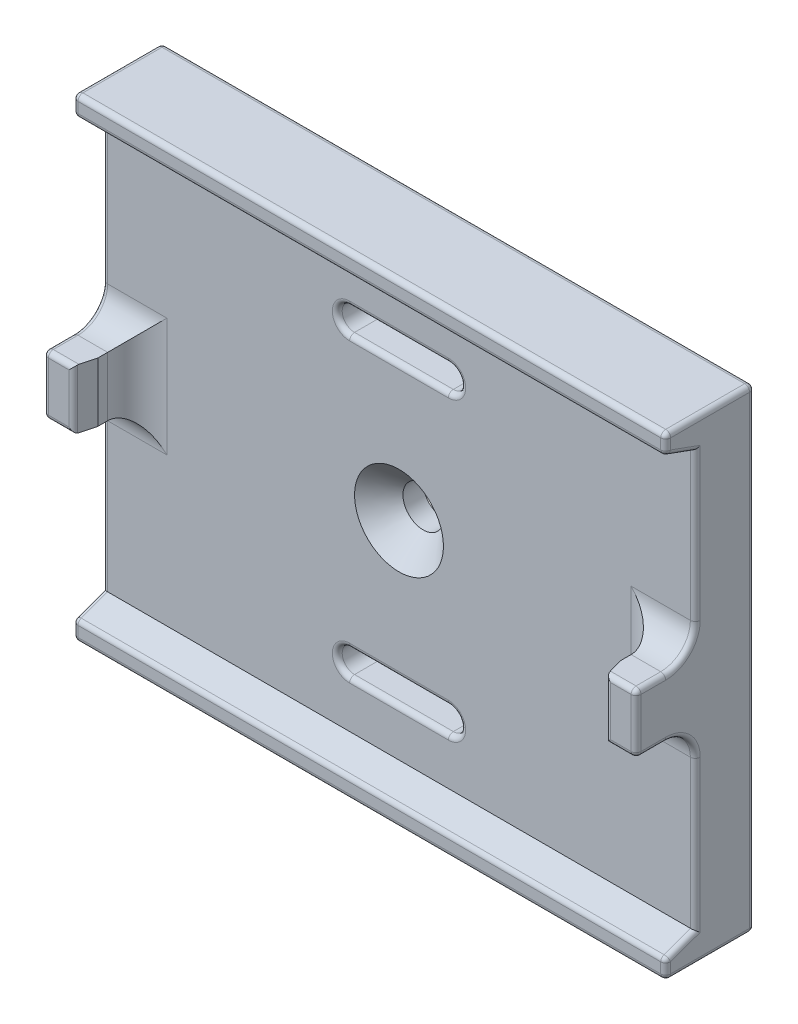
from build123d import *
from OCP.BRepFilletAPI import BRepFilletAPI_MakeChamfer

# Parameters (mm, degrees)
AUFSATZ_LINEAR_AUSTRAGEN1_DEPTH       = 60
AUFSATZ_LINEAR_AUSTRAGEN1_DEPTH_BACK  = 60
FORMSENKUNG_F_R_M8_SFHCS1_D           = 8.2
FORMSENKUNG_F_R_M8_SFHCS1_CSINK_D     = 18
FORMSENKUNG_F_R_M8_SFHCS1_CSINK_ANGLE = 90
SCHNITT_LINEAR_AUSTRAGEN1_DEPTH       = 3
SKIZZE5_W                             = 7
SKIZZE5_H                             = 12
AUFSATZ_LINEAR_AUSTRAGEN2_DEPTH       = 12
FASE1_SIZE                            = 4
FASE1_SIZE2                           = 1.07179677
VERRUNDUNG1_R                         = 6
SCHNITT_LINEAR_AUSTRAGEN2_DEPTH       = 12
VERRUNDUNG2_R                         = 1


with BuildPart() as part:
    # Skizze1 → Aufsatz-Linear austragen1 (new, two sides: drawn at the far end of the back side and taken through both)
    with BuildSketch(Plane(origin=(0, 0, 0), x_dir=(0, 0, -1), z_dir=(1, 0, 0)).offset(-AUFSATZ_LINEAR_AUSTRAGEN1_DEPTH_BACK)):
        Polygon((0, 48), (0, -48), (-18, -48), (-18, -44.183821406), (-12, -42), (-12, 42), (-18, 44.183821406), (-18, 48), align=None)
    extrude(amount=AUFSATZ_LINEAR_AUSTRAGEN1_DEPTH + AUFSATZ_LINEAR_AUSTRAGEN1_DEPTH_BACK)

    # Formsenkung für M8 SFHCS1 (through all)
    with Locations(Plane.XY.offset(12)):
        with Locations((0, 0)):
            CounterSinkHole(FORMSENKUNG_F_R_M8_SFHCS1_D / 2, FORMSENKUNG_F_R_M8_SFHCS1_CSINK_D / 2, counter_sink_angle=FORMSENKUNG_F_R_M8_SFHCS1_CSINK_ANGLE)

    # Skizze4 → Schnitt-Linear austragen1 (cut)
    with BuildSketch(Plane(origin=(0, 0, 0), x_dir=(-1, 0, 0), z_dir=(0, 0, -1))):
        with BuildLine():
            Line((18.25, -20.25), (-18.25, -20.25))
            ThreePointArc((-18.25, -20.25), (-19.664213562, -19.664213562), (-20.25, -18.25))
            Line((-20.25, -18.25), (-20.25, 18.25))
            ThreePointArc((-20.25, 18.25), (-19.664213562, 19.664213562), (-18.25, 20.25))
            Line((-18.25, 20.25), (18.25, 20.25))
            ThreePointArc((18.25, 20.25), (19.664213562, 19.664213562), (20.25, 18.25))
            Line((20.25, 18.25), (20.25, -18.25))
            ThreePointArc((20.25, -18.25), (19.664213562, -19.664213562), (18.25, -20.25))
        make_face()
    extrude(amount=-SCHNITT_LINEAR_AUSTRAGEN1_DEPTH, mode=Mode.SUBTRACT)

    # Skizze5 → Aufsatz-Linear austragen2 (add)
    with BuildSketch(Plane.XY.offset(12)):
        with Locations((-56.5, 0)):
            Rectangle(SKIZZE5_W, SKIZZE5_H)
        with Locations((56.5, 0)):
            Rectangle(SKIZZE5_W, SKIZZE5_H)
    extrude(amount=AUFSATZ_LINEAR_AUSTRAGEN2_DEPTH)

    # Fase1: one chamfer whose edges measure the first distance from different faces: ONE call of the kernel's chamfer builder (chamfer() names one face for all edges)
    fase1_edges_1 = [part.edges().sort_by_distance(p)[0] for p in [
        (-53, 0, 24),
    ]]
    fase1_side_1 = [part.faces().sort_by_distance(p)[0] for p in [
        (-53, 0, 18),
    ]]
    fase1_edges_2 = [part.edges().sort_by_distance(p)[0] for p in [
        (53, 0, 24),
    ]]
    fase1_side_2 = [part.faces().sort_by_distance(p)[0] for p in [
        (53, 0, 18),
    ]]
    fase1 = BRepFilletAPI_MakeChamfer(part.part.solid().wrapped)
    for e in fase1_edges_1:
        fase1.Add(FASE1_SIZE, FASE1_SIZE2, e.wrapped, fase1_side_1[0].wrapped)  # the first distance lies on this face
    for e in fase1_edges_2:
        fase1.Add(FASE1_SIZE, FASE1_SIZE2, e.wrapped, fase1_side_2[0].wrapped)  # the first distance lies on this face
    add(Compound.cast(fase1.Shape()), mode=Mode.REPLACE)

    # Verrundung1
    verrundung1_edges = [part.edges().sort_by_distance(p)[0] for p in [
        (56.5, -6, 12),
        (56.5, 6, 12),
        (-56.5, 6, 12),
        (-56.5, -6, 12),
        (-53, 0, 12),
        (53, 0, 12),
    ]]
    fillet(verrundung1_edges, radius=VERRUNDUNG1_R)

    # Skizze6 → Schnitt-Linear austragen2 (cut)
    with BuildSketch(Plane.XY.offset(12)):
        with BuildLine():
            Line((-10, 32.5), (10, 32.5))
            ThreePointArc((10, 32.5), (12.5, 30), (10, 27.5))
            Line((10, 27.5), (-10, 27.5))
            ThreePointArc((-10, 27.5), (-12.5, 30), (-10, 32.5))
        make_face()
        with BuildLine():
            Line((-10, -32.5), (10, -32.5))
            ThreePointArc((10, -32.5), (12.5, -30), (10, -27.5))
            Line((10, -27.5), (-10, -27.5))
            ThreePointArc((-10, -27.5), (-12.5, -30), (-10, -32.5))
        make_face()
    extrude(amount=-SCHNITT_LINEAR_AUSTRAGEN2_DEPTH, mode=Mode.SUBTRACT)

    # Verrundung2
    verrundung2_edges = [part.edges().sort_by_distance(p)[0] for p in [
        (60, -27, 12),
        (60, -7.757359313, 13.757359313),
        (60, 27, 12),
        (60, 7.757359313, 13.757359313),
        (-60, 6, 21),
        (-60, 27, 12),
        (-60, -27, 12),
        (-60, -6, 21),
        (60, 0, 24),
        (57.035898385, -6, 24),
        (54.07179677, 0, 24),
        (57.035898385, 6, 24),
        (-60, 0, 24),
        (-57.035898385, 6, 24),
        (-54.07179677, 0, 24),
        (-57.035898385, -6, 24),
        (0, 48, 18),
        (-60, 46.091910703, 18),
        (0, 44.183821406, 18),
        (60, 46.091910703, 18),
        (60, -46.091910703, 18),
        (-60, -46.091910703, 18),
        (0, -44.183821406, 18),
        (0, -48, 18),
        (-60, -48, 9),
        (-60, 48, 9),
        (-60, 0, 0),
        (0, -48, 0),
        (60, -48, 9),
        (60, 48, 9),
        (60, 0, 0),
        (0, 48, 0),
        (60, -6, 21),
        (60, 6, 21),
        (-60, 7.757359313, 13.757359313),
        (-60, -7.757359313, 13.757359313),
        (12.5, 30, 0),
        (0, 27.5, 0),
        (-12.5, 30, 0),
        (12.5, -30, 0),
        (0, -32.5, 0),
        (-12.5, -30, 0),
        (-12.5, 30, 12),
        (0, 32.5, 12),
        (12.5, 30, 12),
        (12.5, -30, 12),
        (0, -32.5, 12),
        (-12.5, -30, 12),
        (0, 32.5, 0),
        (0, -27.5, 0),
        (0, 27.5, 12),
        (0, -27.5, 12),
        (60, -43.091910703, 15),
        (60, 43.091910703, 15),
        (-60, -43.091910703, 15),
        (-60, 43.091910703, 15),
    ]]
    fillet(verrundung2_edges, radius=VERRUNDUNG2_R)


solid = part.part
